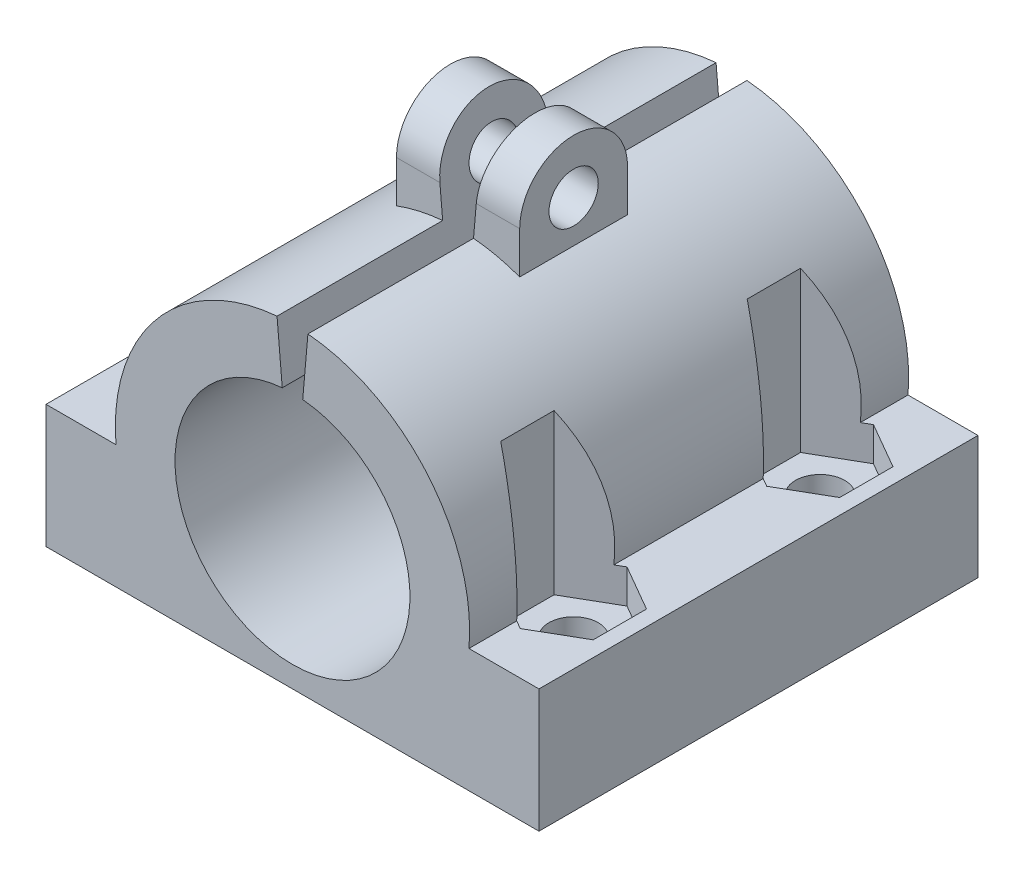
from build123d import *

# Parameters (mm, degrees)
SKETCH1_W                = 32
SKETCH1_H                = 28.5
BOSS_EXTRUDE1_DEPTH      = 8
BOSS_EXTRUDE2_DEPTH      = 28.5
SKETCH4_R                = 7.625
CUT_EXTRUDE2_DEPTH       = 26.5
SKETCH5_R                = 6
CUT_EXTRUDE3_DEPTH       = 39.581083448
CUT_EXTRUDE1_DEPTH       = 25.805493343
CUT_EXTRUDE1_DEPTH_BACK  = 25.805493343
SKETCH2_R                = 1.6
CUT_EXTRUDE4_DEPTH       = 25.805493451
CUT_EXTRUDE4_DEPTH_BACK  = 2.2
BOSS_EXTRUDE3_DEPTH      = 4
BOSS_EXTRUDE3_DEPTH_BACK = 4
SKETCH8_R                = 1.6
CUT_EXTRUDE5_DEPTH       = 42.764219136


with BuildPart() as part:
    # Sketch1 → Boss-Extrude1 (new body)
    with BuildSketch(Plane(origin=(0, 0, 0), x_dir=(1, 0, 0), z_dir=(0, 1, 0))):
        Rectangle(SKETCH1_W, SKETCH1_H)
    extrude(amount=BOSS_EXTRUDE1_DEPTH)

    # Sketch3 → Boss-Extrude2 (add, through all)
    with BuildSketch(Plane.XY.offset(14.25)):
        with BuildLine():
            Line((-7.158910532, 0), (7.158910532, 0))
            ThreePointArc((7.158910532, 0), (0, 20.5), (-7.158910532, 0))
        make_face()
    extrude(amount=-BOSS_EXTRUDE2_DEPTH)

    # Sketch4 → Cut-Extrude2 (cut)
    with BuildSketch(Plane.XY.offset(14.25)):
        with Locations((0, 9)):
            Circle(SKETCH4_R)
    extrude(amount=-CUT_EXTRUDE2_DEPTH, mode=Mode.SUBTRACT)

    # Sketch5 → Cut-Extrude3 (cut, through all)
    with BuildSketch(Plane(origin=(0, 0, -14.25), x_dir=(-1, 0, 0), z_dir=(0, 0, -1))):
        with Locations((0, 9)):
            Circle(SKETCH5_R)
    extrude(amount=-CUT_EXTRUDE3_DEPTH, mode=Mode.SUBTRACT)

    # Sketch2 → Cut-Extrude1 (cut, two sides: drawn at the far end of the back side and taken through both)
    with BuildSketch(Plane(origin=(0, 8, 0), x_dir=(1, 0, 0), z_dir=(0, 1, 0)).offset(-CUT_EXTRUDE1_DEPTH_BACK)):
        with Locations(Location((-12, 8, 0), (0, 0, 270))):
            Circle(SKETCH2_R)
        with Locations(Location((12, 8, 0), (0, 0, 250.139850489))):
            Circle(SKETCH2_R)
        with Locations(Location((12, -8, 0), (0, 0, 270))):
            Circle(SKETCH2_R)
        with Locations(Location((-12, -8, 0), (0, 0, 289.860135815))):
            Circle(SKETCH2_R)
    extrude(amount=CUT_EXTRUDE1_DEPTH + CUT_EXTRUDE1_DEPTH_BACK, mode=Mode.SUBTRACT)

    # Sketch6 → Cut-Extrude4 (cut, two sides: drawn at the far end of the back side and taken through both)
    with BuildSketch(Plane(origin=(0, 8, 0), x_dir=(1, 0, 0), z_dir=(0, 1, 0)).offset(-CUT_EXTRUDE4_DEPTH_BACK)):
        Polygon((-12, 11.464101615), (-15, 9.732050808), (-15, 6.267949192), (-12, 4.535898385), (-9, 6.267949192), (-9, 9.732050808), align=None)
        Polygon((-9, -9.732050808), (-12, -11.464101615), (-15, -9.732050808), (-15, -6.267949192), (-12, -4.535898385), (-9, -6.267949192), align=None)
        Polygon((12, -11.464101615), (15, -9.732050808), (15, -6.267949192), (12, -4.535898385), (9, -6.267949192), (9, -9.732050808), align=None)
        Polygon((9, 9.732050808), (12, 11.464101615), (15, 9.732050808), (15, 6.267949192), (12, 4.535898385), (9, 6.267949192), align=None)
    extrude(amount=CUT_EXTRUDE4_DEPTH + CUT_EXTRUDE4_DEPTH_BACK, mode=Mode.SUBTRACT)

    # Sketch8 → Boss-Extrude3 (add, two sides: drawn at the far end of the back side and taken through both)
    with BuildSketch(Plane(origin=(0, 0, 0), x_dir=(0, 0, -1), z_dir=(1, 0, 0)).offset(-BOSS_EXTRUDE3_DEPTH_BACK)):
        with BuildLine():
            Line((-3.5, 22.5), (-3.5, 18.5))
            Line((-3.5, 18.5), (3.5, 18.5))
            Line((3.5, 18.5), (3.5, 22.5))
            ThreePointArc((3.5, 22.5), (0, 26), (-3.5, 22.5))
        make_face()
        with Locations((0, 22.5)):
            Circle(SKETCH8_R, mode=Mode.SUBTRACT)
    extrude(amount=BOSS_EXTRUDE3_DEPTH + BOSS_EXTRUDE3_DEPTH_BACK)

    # Sketch9 → Cut-Extrude5 (cut, through all)
    with BuildSketch(Plane.XY.offset(14.25)):
        with BuildLine():
            Line((0, 9), (1.743114855, 28.923893962))
            ThreePointArc((1.743114855, 28.923893962), (0, 29), (-1.743114855, 28.923893962))
            Line((-1.743114855, 28.923893962), (0, 9))
        make_face()
    extrude(amount=-CUT_EXTRUDE5_DEPTH, mode=Mode.SUBTRACT)


solid = part.part
